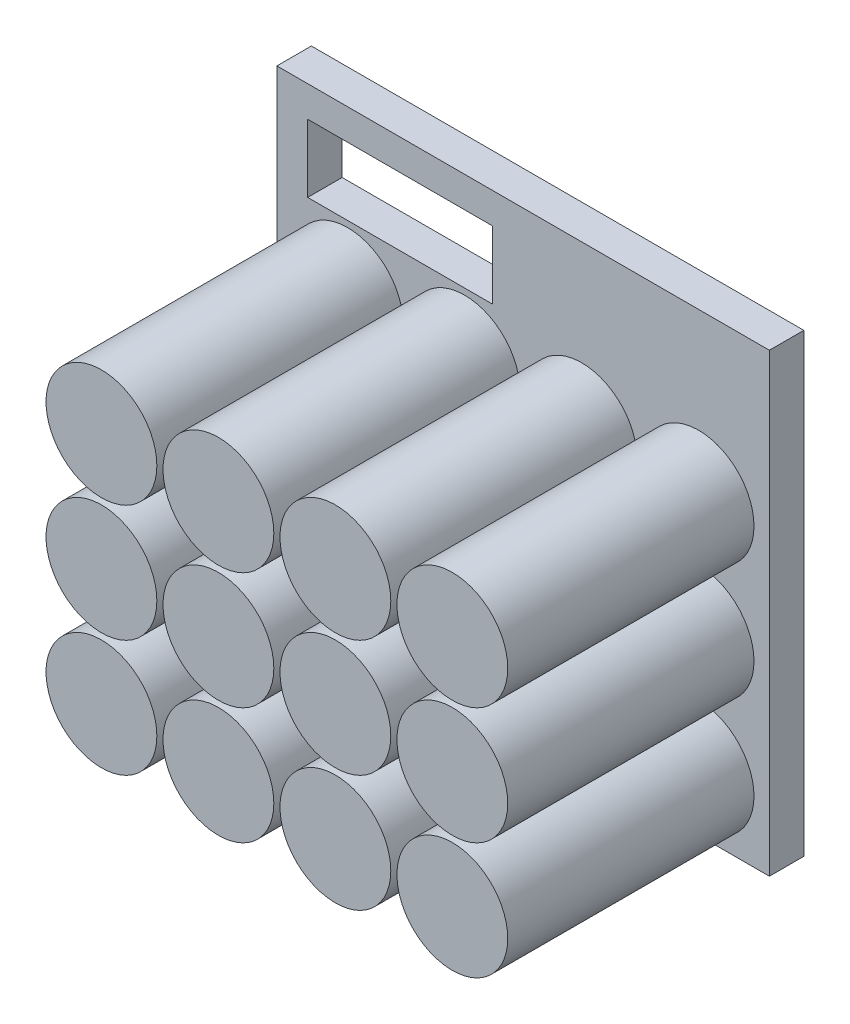
from build123d import *

# Parameters (mm, degrees)
SKETCH_1_W      = 80
SKETCH_1_H      = 74
SKETCH_1_W_2    = 30
SKETCH_1_H_2    = 11
EXTRUDE_1_DEPTH = 5.6
SKETCH_2_R      = 9
EXTRUDE_2_DEPTH = 40


with BuildPart() as part:
    # 草图1 → 凸台-拉伸1 (new body)
    with BuildSketch(Plane.XY):
        with Locations((4.975124378, -23.343283582)):
            Rectangle(SKETCH_1_W, SKETCH_1_H)
        with Locations((-15.024875622, 3.156716418)):
            Rectangle(SKETCH_1_W_2, SKETCH_1_H_2, mode=Mode.SUBTRACT)
    extrude(amount=-EXTRUDE_1_DEPTH)

    # 草图2 → 凸台-拉伸2 (add)
    with BuildSketch(Plane.XY):
        with Locations((-23.524875622, -50.343283582)):
            Circle(SKETCH_2_R)
        with Locations((-4.524875622, -50.343283582)):
            Circle(SKETCH_2_R)
        with Locations((14.475124378, -50.343283582)):
            Circle(SKETCH_2_R)
        with Locations((33.475124378, -50.343283582)):
            Circle(SKETCH_2_R)
        with Locations((-4.524875622, -31.343283582)):
            Circle(SKETCH_2_R)
        with Locations((14.475124378, -31.343283582)):
            Circle(SKETCH_2_R)
        with Locations((33.475124378, -31.343283582)):
            Circle(SKETCH_2_R)
        with Locations((-4.524875622, -12.343283582)):
            Circle(SKETCH_2_R)
        with Locations((14.475124378, -12.343283582)):
            Circle(SKETCH_2_R)
        with Locations((33.475124378, -12.343283582)):
            Circle(SKETCH_2_R)
        with Locations((-23.524875622, -31.343283582)):
            Circle(SKETCH_2_R)
        with Locations((-23.524875622, -12.343283582)):
            Circle(SKETCH_2_R)
    extrude(amount=EXTRUDE_2_DEPTH)


solid = part.part
